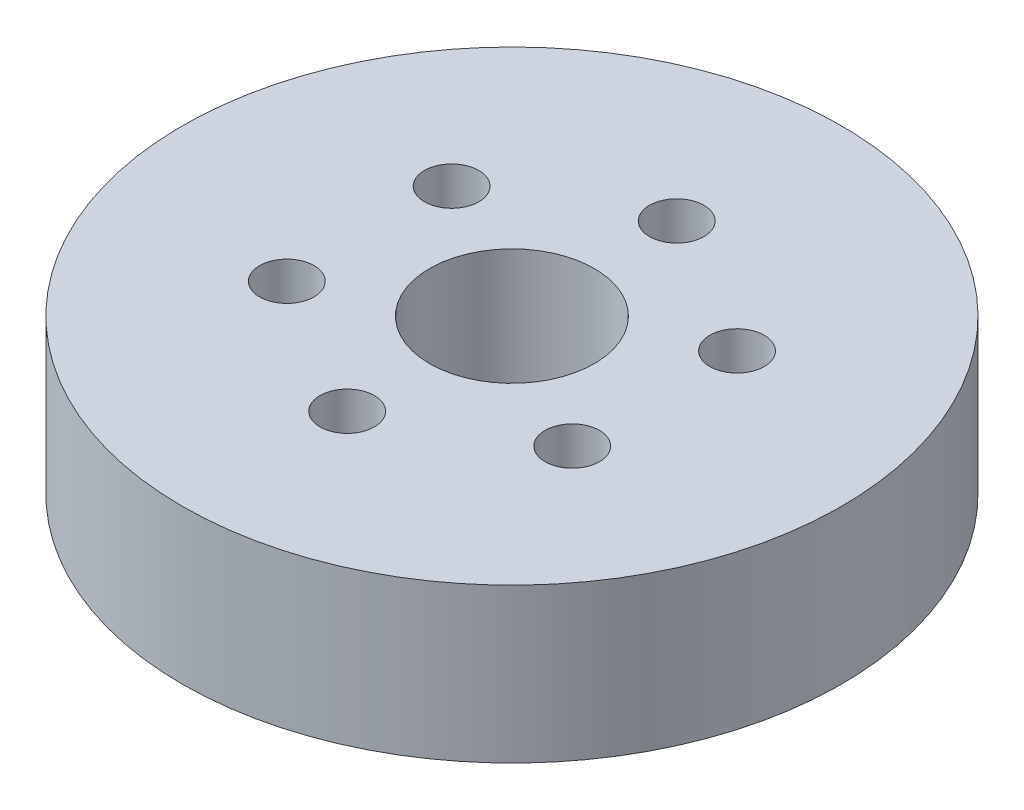
from build123d import *

# Parameters (mm, degrees)
SKETCH1_R             = 20
SKETCH1_R_2           = 1
SKETCH1_R_3           = 5
BOSS_EXTRUDE1_DEPTH   = 9.35
M4X0_7_TAPPED_HOLE1_D = 3.3


with BuildPart() as part:
    # Sketch1 → Boss-Extrude1 (new body)
    with BuildSketch(Plane(origin=(0, 0, 0), x_dir=(1, 0, 0), z_dir=(0, 1, 0))):
        Circle(SKETCH1_R)
        with Locations((0, 10)):
            Circle(SKETCH1_R_2, mode=Mode.SUBTRACT)
        with Locations((8.660254038, 5)):
            Circle(SKETCH1_R_2, mode=Mode.SUBTRACT)
        with Locations((8.660254038, -5)):
            Circle(SKETCH1_R_2, mode=Mode.SUBTRACT)
        with Locations((0, -10)):
            Circle(SKETCH1_R_2, mode=Mode.SUBTRACT)
        with Locations((-8.660254038, -5)):
            Circle(SKETCH1_R_2, mode=Mode.SUBTRACT)
        with Locations((-8.660254038, 5)):
            Circle(SKETCH1_R_2, mode=Mode.SUBTRACT)
        Circle(SKETCH1_R_3, mode=Mode.SUBTRACT)
    extrude(amount=BOSS_EXTRUDE1_DEPTH)

    # M4x0.7 Tapped Hole1 (through all)
    with Locations(Plane(origin=(-8.660254038, 0, 5), x_dir=(0, 0, -1), z_dir=(0, -1, 0))):
        with Locations((0, 0), (-5, 8.660254038), (0, 17.320508076), (10, 17.320508076), (15, 8.660254038), (10, 0)):
            Hole(M4X0_7_TAPPED_HOLE1_D / 2)


solid = part.part
